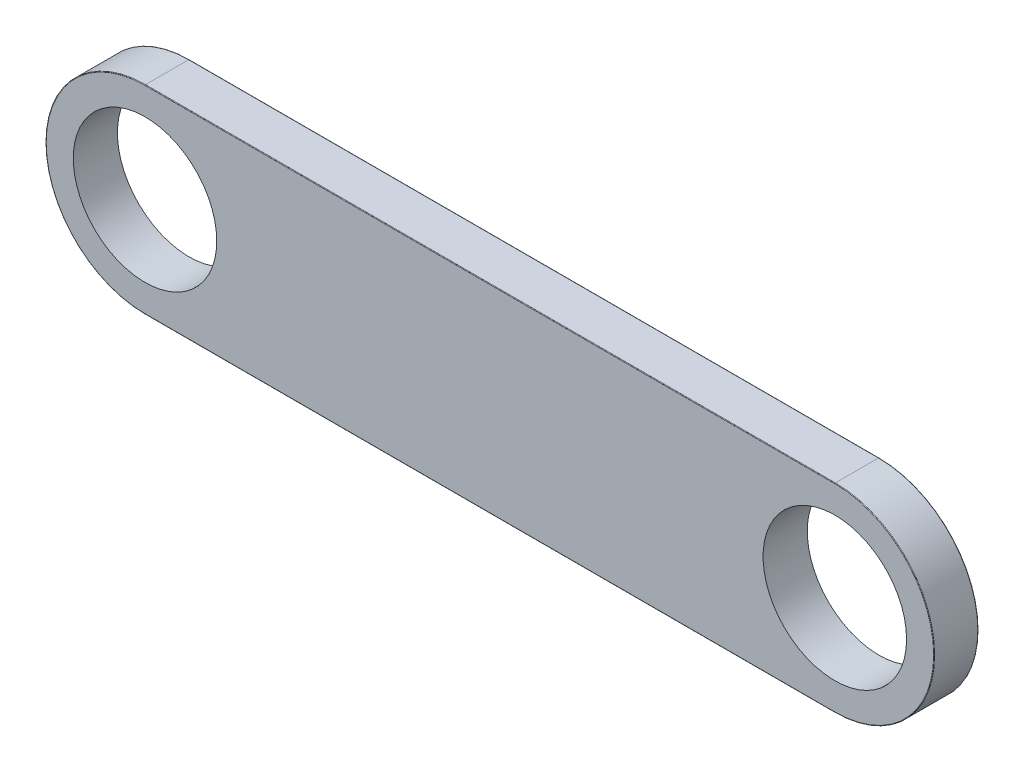
from build123d import *

# Parameters (mm, degrees)
SKETCH1_R           = 13
BOSS_EXTRUDE1_DEPTH = 8
FILLET1_R           = 0.1


with BuildPart() as part:
    # Sketch1 → Boss-Extrude1 (new body)
    with BuildSketch(Plane.XY):
        with BuildLine():
            Line((0, 18), (125, 18))
            ThreePointArc((125, 18), (143, 0), (125, -18))
            Line((125, -18), (0, -18))
            ThreePointArc((0, -18), (-18, 0), (0, 18))
        make_face()
        Circle(SKETCH1_R, mode=Mode.SUBTRACT)
        with Locations((125, 0)):
            Circle(SKETCH1_R, mode=Mode.SUBTRACT)
    extrude(amount=BOSS_EXTRUDE1_DEPTH)

    # Fillet1
    fillet1_edges = [part.edges().sort_by_distance(p)[0] for p in [
        (143, 0, 8),
        (62.5, 18, 8),
        (-18, 0, 8),
        (62.5, 18, 0),
        (143, 0, 0),
        (62.5, -18, 0),
        (-18, 0, 0),
        (62.5, -18, 8),
    ]]
    fillet(fillet1_edges, radius=FILLET1_R)


solid = part.part
